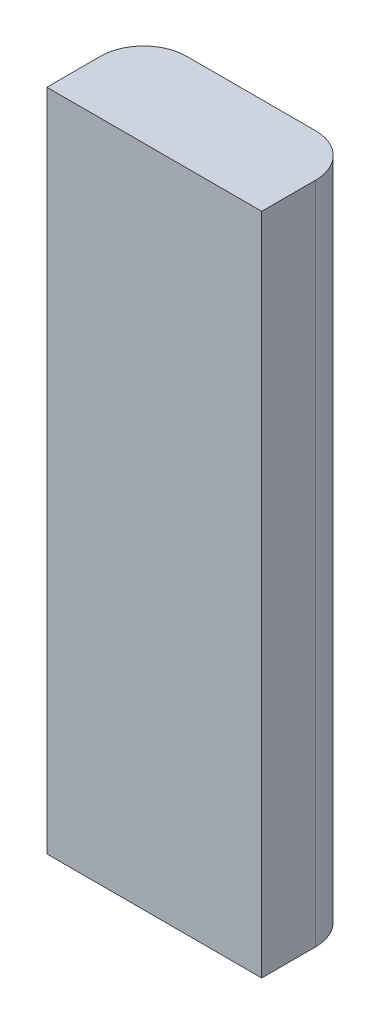
from build123d import *

# Parameters (mm, degrees)
BOSS_EXTRUDE1_DEPTH = 392.43


with BuildPart() as part:
    # Sketch1 → Boss-Extrude1 (new body)
    with BuildSketch(Plane(origin=(0, 0, 0), x_dir=(1, 0, 0), z_dir=(0, 1, 0))):
        with BuildLine():
            Line((0, 0), (127, 0))
            Line((127, 0), (127, 31.75))
            ThreePointArc((127, 31.75), (119.560512242, 49.710512242), (101.6, 57.15))
            Line((101.6, 57.15), (25.4, 57.15))
            ThreePointArc((25.4, 57.15), (7.439487758, 49.710512242), (0, 31.75))
            Line((0, 31.75), (0, 0))
        make_face()
    extrude(amount=BOSS_EXTRUDE1_DEPTH)


solid = part.part
